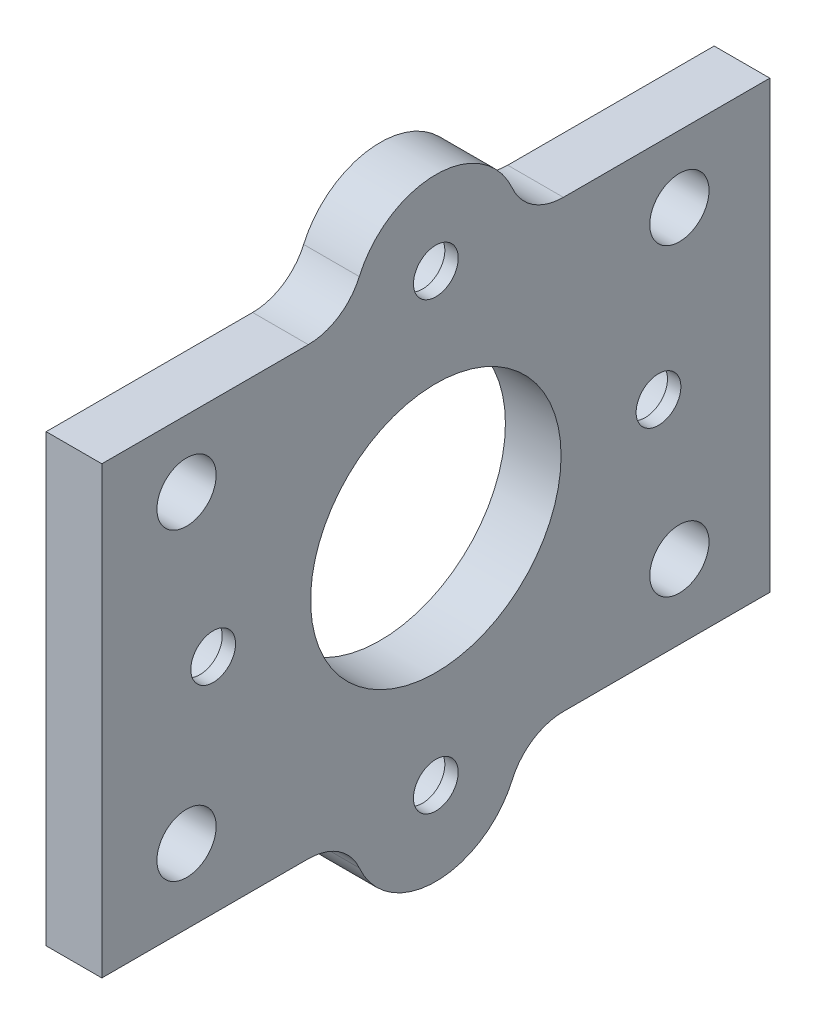
from build123d import *

# Parameters (mm, degrees)
BOSS_EXTRUDE1_DEPTH                             = 6.35
SKETCH2_R                                       = 14.2875
CUT_EXTRUDE1_DEPTH                              = 98.395421479
CBORE_FOR_10_SOCKET_HEAD_CAP_SCREW1_D           = 5.1054
CBORE_FOR_10_SOCKET_HEAD_CAP_SCREW1_CBORE_D     = 9.525
CBORE_FOR_10_SOCKET_HEAD_CAP_SCREW1_CBORE_DEPTH = 4.826
F_1_4_CLEARANCE_HOLE1_D                         = 6.7564


with BuildPart() as part:
    # Sketch1 → Boss-Extrude1 (new body)
    with BuildSketch(Plane(origin=(0, 0, 0), x_dir=(0, 0, -1), z_dir=(1, 0, 0))):
        with BuildLine():
            Line((52.649677831, 50.8), (76.2, 50.8))
            Line((76.2, 50.8), (76.2, 0))
            Line((76.2, 0), (52.649677831, 0))
            ThreePointArc((52.649677831, 0), (49.171639591, -1.037208832), (46.829806699, -3.81))
            ThreePointArc((46.829806699, -3.81), (38.1, -9.525), (29.370193301, -3.81))
            ThreePointArc((29.370193301, -3.81), (27.028360409, -1.037208832), (23.550322169, 0))
            Line((23.550322169, 0), (0, 0))
            Line((0, 0), (0, 50.8))
            Line((0, 50.8), (23.550322169, 50.8))
            ThreePointArc((23.550322169, 50.8), (27.028360409, 51.837208832), (29.370193301, 54.61))
            ThreePointArc((29.370193301, 54.61), (38.1, 60.325), (46.829806699, 54.61))
            ThreePointArc((46.829806699, 54.61), (49.171639591, 51.837208832), (52.649677831, 50.8))
        make_face()
    extrude(amount=BOSS_EXTRUDE1_DEPTH)

    # Sketch2 → Cut-Extrude1 (cut, through all)
    with BuildSketch(Plane(origin=(6.35, 0, 0), x_dir=(0, 0, -1), z_dir=(1, 0, 0))):
        with Locations((38.1, 25.4)):
            Circle(SKETCH2_R)
    extrude(amount=-CUT_EXTRUDE1_DEPTH, mode=Mode.SUBTRACT)

    # CBORE for #10 Socket Head Cap Screw1 (through all)
    with Locations(Plane.ZY):
        with Locations((-63.5, 25.4), (-38.1, 50.8), (-12.7, 25.4), (-38.1, 0)):
            CounterBoreHole(CBORE_FOR_10_SOCKET_HEAD_CAP_SCREW1_D / 2, CBORE_FOR_10_SOCKET_HEAD_CAP_SCREW1_CBORE_D / 2, CBORE_FOR_10_SOCKET_HEAD_CAP_SCREW1_CBORE_DEPTH)

    # 1/4 Clearance Hole1 (through all)
    with Locations(Plane(origin=(6.35, 0, 0), x_dir=(0, 0, -1), z_dir=(1, 0, 0))):
        with Locations((9.661126973, 43.174295642), (65.884030556, 43.174295642), (65.884030556, 8.467644678), (9.661126973, 8.467644678)):
            Hole(F_1_4_CLEARANCE_HOLE1_D / 2)


solid = part.part
